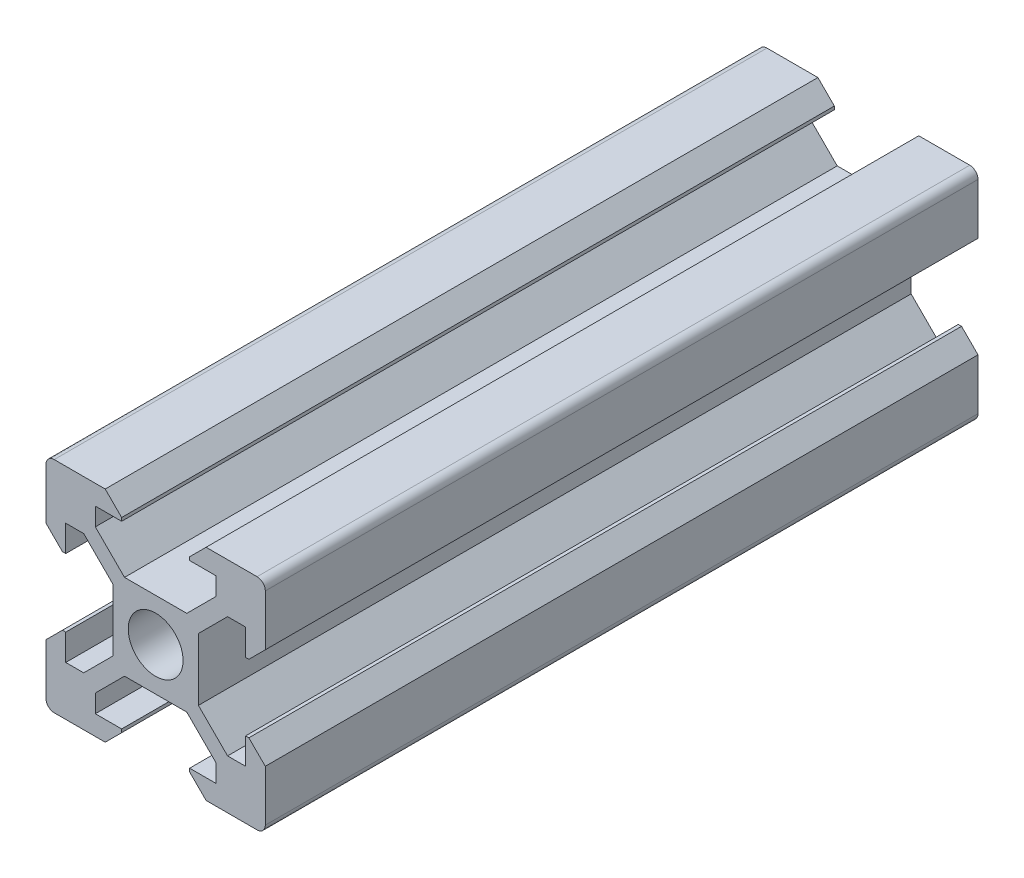
from build123d import *

# Parameters (mm, degrees)
CROQUIS1_R              = 2.5
SALIENTE_EXTRUIR1_DEPTH = 480
CUT_EXTRUDE1_DEPTH      = 47
CUT_EXTRUDE1_DEPTH_BACK = 46
SKETCH2_W               = 830
SKETCH2_H               = 37.339467532


with BuildPart() as part:
    # Croquis1 → Saliente-Extruir1 (new body)
    with BuildSketch(Plane.XY):
        with BuildLine():
            Line((-4.6, 10), (-3.1, 8.5))
            Line((-3.1, 8.5), (-3.1, 8.2))
            Line((-3.1, 8.2), (-5.5, 8.2))
            Line((-5.5, 8.2), (-5.5, 6.560660172))
            Line((-5.5, 6.560660172), (-2.84, 3.900660172))
            Line((-2.84, 3.900660172), (0, 3.900660172))
            Line((0, 3.900660172), (2.84, 3.900660172))
            Line((2.84, 3.900660172), (5.5, 6.560660172))
            Line((5.5, 6.560660172), (5.5, 8.2))
            Line((5.5, 8.2), (3.1, 8.2))
            Line((3.1, 8.2), (3.1, 8.5))
            Line((3.1, 8.5), (4.6, 10))
            Line((4.6, 10), (9.25, 10))
            ThreePointArc((9.25, 10), (9.780330086, 9.780330086), (10, 9.25))
            Line((10, 9.25), (10, 4.6))
            Line((10, 4.6), (8.5, 3.1))
            Line((8.5, 3.1), (8.2, 3.1))
            Line((8.2, 3.1), (8.2, 5.5))
            Line((8.2, 5.5), (6.560660172, 5.5))
            Line((6.560660172, 5.5), (3.900660172, 2.84))
            Line((3.900660172, 2.84), (3.900660172, 0))
            Line((3.900660172, 0), (3.900660172, -2.84))
            Line((3.900660172, -2.84), (6.560660172, -5.5))
            Line((6.560660172, -5.5), (8.2, -5.5))
            Line((8.2, -5.5), (8.2, -3.1))
            Line((8.2, -3.1), (8.5, -3.1))
            Line((8.5, -3.1), (10, -4.6))
            Line((10, -4.6), (10, -9.25))
            ThreePointArc((10, -9.25), (9.780330086, -9.780330086), (9.25, -10))
            Line((9.25, -10), (4.6, -10))
            Line((4.6, -10), (3.1, -8.5))
            Line((3.1, -8.5), (3.1, -8.2))
            Line((3.1, -8.2), (5.5, -8.2))
            Line((5.5, -8.2), (5.5, -6.560660172))
            Line((5.5, -6.560660172), (2.84, -3.900660172))
            Line((2.84, -3.900660172), (0, -3.900660172))
            Line((0, -3.900660172), (-2.84, -3.900660172))
            Line((-2.84, -3.900660172), (-5.5, -6.560660172))
            Line((-5.5, -6.560660172), (-5.5, -8.2))
            Line((-5.5, -8.2), (-3.1, -8.2))
            Line((-3.1, -8.2), (-3.1, -8.5))
            Line((-3.1, -8.5), (-4.6, -10))
            Line((-4.6, -10), (-9.25, -10))
            ThreePointArc((-9.25, -10), (-9.780330086, -9.780330086), (-10, -9.25))
            Line((-10, -9.25), (-10, -4.6))
            Line((-10, -4.6), (-8.5, -3.1))
            Line((-8.5, -3.1), (-8.2, -3.1))
            Line((-8.2, -3.1), (-8.2, -5.5))
            Line((-8.2, -5.5), (-6.560660172, -5.5))
            Line((-6.560660172, -5.5), (-3.900660172, -2.84))
            Line((-3.900660172, -2.84), (-3.900660172, 0))
            Line((-3.900660172, 0), (-3.900660172, 2.84))
            Line((-3.900660172, 2.84), (-6.560660172, 5.5))
            Line((-6.560660172, 5.5), (-8.2, 5.5))
            Line((-8.2, 5.5), (-8.2, 3.1))
            Line((-8.2, 3.1), (-8.5, 3.1))
            Line((-8.5, 3.1), (-10, 4.6))
            Line((-10, 4.6), (-10, 9.25))
            ThreePointArc((-10, 9.25), (-9.780330086, 9.780330086), (-9.25, 10))
            Line((-9.25, 10), (-4.6, 10))
        make_face()
        Circle(CROQUIS1_R, mode=Mode.SUBTRACT)
    extrude(amount=SALIENTE_EXTRUIR1_DEPTH)

    # Sketch2 → Cut-Extrude1 (cut, two sides: drawn at the far end of the back side and taken through both)
    with BuildSketch(Plane(origin=(0, 0, 0), x_dir=(0, 0, -1), z_dir=(1, 0, 0)).offset(-CUT_EXTRUDE1_DEPTH_BACK)):
        Rectangle(SKETCH2_W, SKETCH2_H)
    extrude(amount=CUT_EXTRUDE1_DEPTH + CUT_EXTRUDE1_DEPTH_BACK, mode=Mode.SUBTRACT)


solid = part.part
